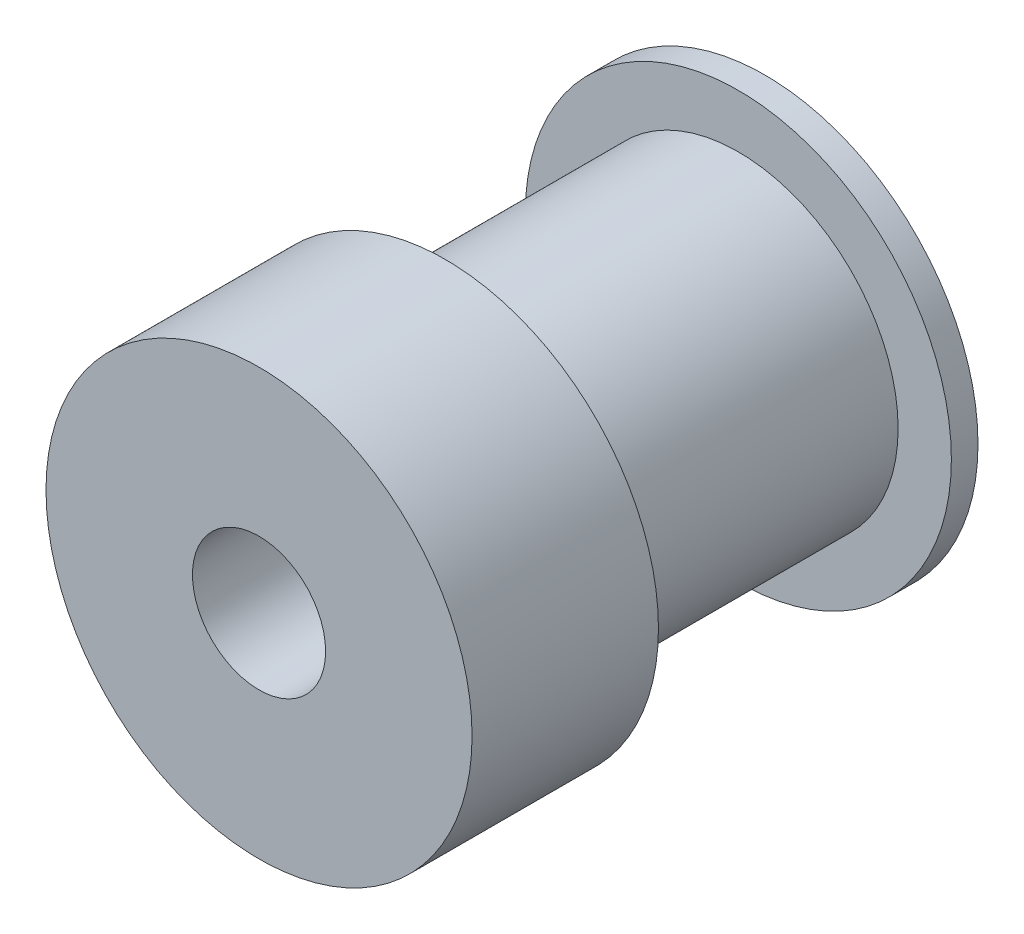
from build123d import *

# Parameters (mm, degrees)
SKETCH_1_R          = 8
EXTRUDE_1_DEPTH     = 19
CUT_EXTRUDE_START   = -18
SKETCH_2_R          = 8
SKETCH_2_R_2        = 6
CUT_EXTRUDE_3_DEPTH = 11
SKETCH_3_R          = 2.5
CUT_EXTRUDE_4_DEPTH = 23.113344387


with BuildPart() as part:
    # 草图1 → 凸台-拉伸1 (new body)
    with BuildSketch(Plane.XY):
        Circle(SKETCH_1_R)
    extrude(amount=EXTRUDE_1_DEPTH)

    # 草图2 → 切除-拉伸3 (cut)
    with BuildSketch(Plane.XY.offset(19).offset(CUT_EXTRUDE_START)):
        Circle(SKETCH_2_R)
        Circle(SKETCH_2_R_2, mode=Mode.SUBTRACT)
    extrude(amount=CUT_EXTRUDE_3_DEPTH, mode=Mode.SUBTRACT)

    # 草图3 → 切除-拉伸4 (cut, through all)
    with BuildSketch(Plane.XY.offset(19)):
        Circle(SKETCH_3_R)
    extrude(amount=-CUT_EXTRUDE_4_DEPTH, mode=Mode.SUBTRACT)


solid = part.part
